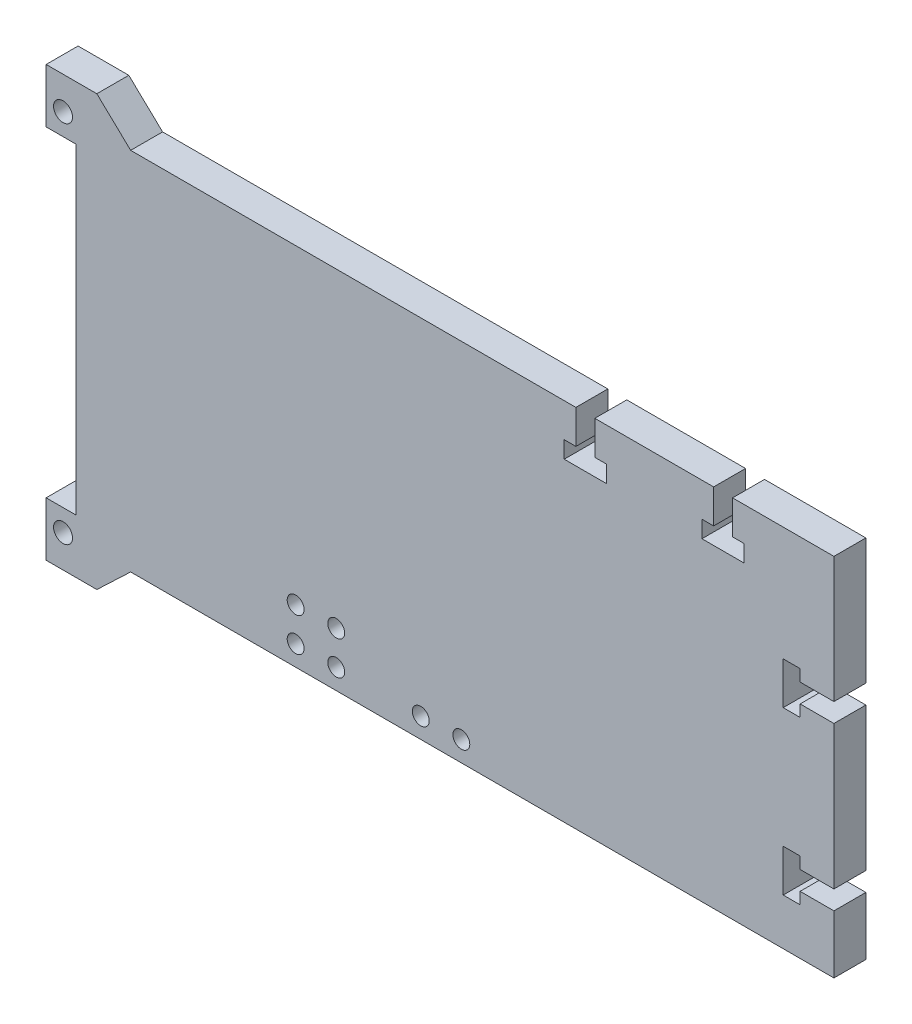
from build123d import *

# Parameters (mm, degrees)
SKETCH1_W           = 142.367
SKETCH1_H           = 68.58
BOSS_EXTRUDE1_DEPTH = 6
SKETCH2_W           = 5.588
SKETCH2_H           = 4.1275
BOSS_EXTRUDE2_DEPTH = 6
BOSS_EXTRUDE3_DEPTH = 6
CUT_EXTRUDE1_DEPTH  = 160.827015204
BOSS_EXTRUDE4_DEPTH = 6
SKETCH6_R           = 1.778
SKETCH6_R_2         = 1.5875
CUT_EXTRUDE2_DEPTH  = 161.845851191


with BuildPart() as part:
    # Sketch1 → Boss-Extrude1 (new body)
    with BuildSketch(Plane.XY):
        with Locations((71.1835, 34.29)):
            Rectangle(SKETCH1_W, SKETCH1_H)
    extrude(amount=BOSS_EXTRUDE1_DEPTH)

    # Sketch2 → Boss-Extrude2 (add)
    with BuildSketch(Plane.XY.offset(6)):
        with Locations((-2.794, 66.51625)):
            Rectangle(SKETCH2_W, SKETCH2_H)
        with Locations((-2.794, 2.06375)):
            Rectangle(SKETCH2_W, SKETCH2_H)
    extrude(amount=-BOSS_EXTRUDE2_DEPTH)

    # Sketch3 → Boss-Extrude3 (add)
    with BuildSketch(Plane.XY.offset(6)):
        Polygon((0, 68.58), (0, 72.39), (2.54, 72.39), (9.525, 68.58), align=None)
        Polygon((0, 0), (0, -3.81), (2.54, -3.81), (9.525, 0), align=None)
    extrude(amount=-BOSS_EXTRUDE3_DEPTH)

    # Sketch4 → Cut-Extrude1 (cut, through all)
    with BuildSketch(Plane.XY.offset(6)):
        Polygon((142.367, 44.958), (136.017, 44.958), (136.017, 47.14875), (132.842, 47.14875), (132.842, 39.21125), (136.017, 39.21125), (136.017, 41.402), (142.367, 41.402), align=None)
        Polygon((142.367, 14.478), (136.017, 14.478), (136.017, 16.66875), (132.842, 16.66875), (132.842, 8.73125), (136.017, 8.73125), (136.017, 10.922), (142.367, 10.922), align=None)
        Polygon((93.9038, 62.23), (91.71305, 62.23), (91.71305, 59.055), (99.65055, 59.055), (99.65055, 62.23), (97.4598, 62.23), (97.4598, 68.58), (93.9038, 68.58), align=None)
        Polygon((123.33224, 68.58), (119.77624, 68.58), (119.77624, 62.23), (117.58549, 62.23), (117.58549, 59.055), (125.52299, 59.055), (125.52299, 62.23), (123.33224, 62.23), align=None)
    extrude(amount=-CUT_EXTRUDE1_DEPTH, mode=Mode.SUBTRACT)

    # Sketch5 → Boss-Extrude4 (add)
    with BuildSketch(Plane.XY.offset(6)):
        Polygon((10.287, 0), (3.937, -6.0325), (-5.588, -6.0325), (-5.588, 0), align=None)
        Polygon((-5.588, 68.58), (10.287, 68.58), (3.937, 74.6125), (-5.588, 74.6125), align=None)
    extrude(amount=-BOSS_EXTRUDE4_DEPTH)

    # Sketch6 → Cut-Extrude2 (cut, through all)
    with BuildSketch(Plane.XY.offset(6)):
        with Locations((-2.413, 68.5165)):
            Circle(SKETCH6_R)
        with Locations((-2.413, 0.0635)):
            Circle(SKETCH6_R)
        with Locations((64.77, 3.81)):
            Circle(SKETCH6_R_2)
        with Locations((72.39, 3.81)):
            Circle(SKETCH6_R_2)
        with Locations((41.275, 3.81)):
            Circle(SKETCH6_R_2)
        with Locations((48.895, 3.81)):
            Circle(SKETCH6_R_2)
        with Locations((41.275, 10.16)):
            Circle(SKETCH6_R_2)
        with Locations((48.895, 10.16)):
            Circle(SKETCH6_R_2)
    extrude(amount=-CUT_EXTRUDE2_DEPTH, mode=Mode.SUBTRACT)


solid = part.part
